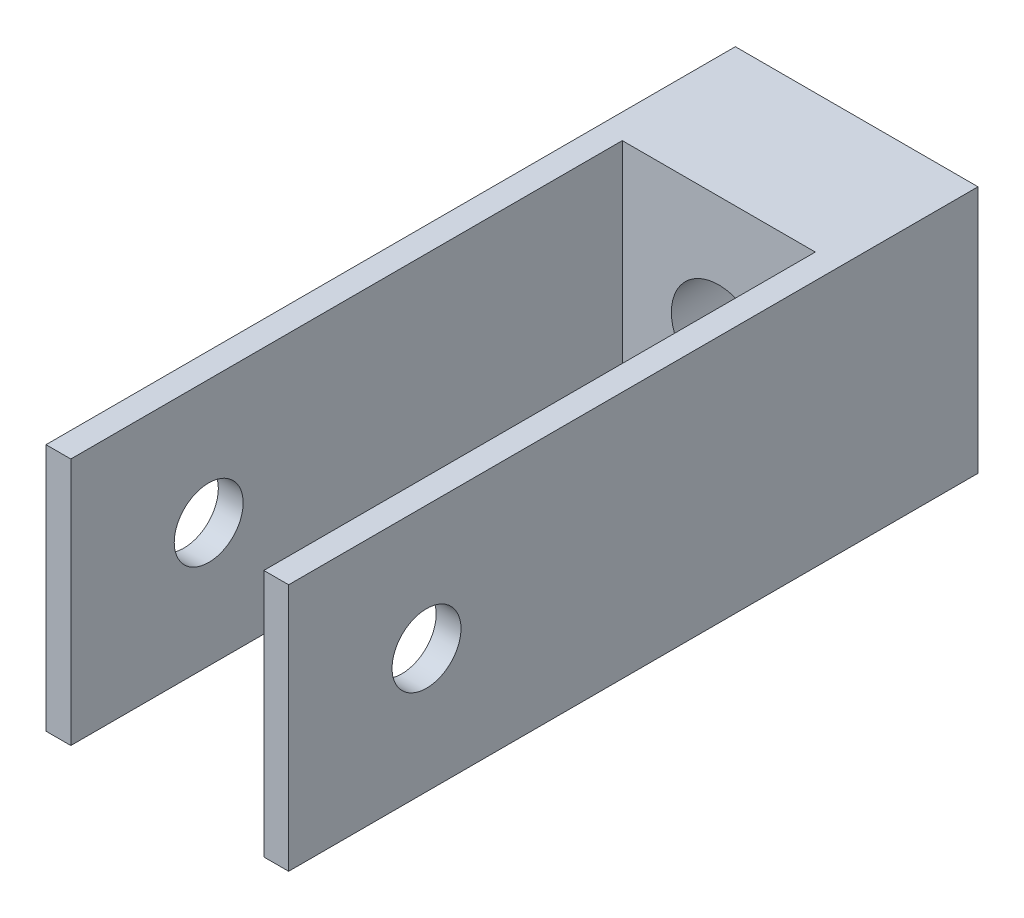
from build123d import *

# Parameters (mm, degrees)
BOSS_EXTRUDE1_DEPTH = 22.86
SKETCH2_R           = 3.175
CUT_EXTRUDE1_DEPTH  = 50.737325059
SKETCH3_R           = 4.365625
CUT_EXTRUDE2_DEPTH  = 23.622


with BuildPart() as part:
    # Sketch1 → Boss-Extrude1 (new body)
    with BuildSketch(Plane(origin=(0, 0, 0), x_dir=(1, 0, 0), z_dir=(0, 1, 0))):
        Polygon((-11.176, -25.4), (-8.89, -25.4), (-8.89, 25.4), (8.89, 25.4), (8.89, -25.4), (11.176, -25.4), (11.176, 38.1), (-11.176, 38.1), align=None)
    extrude(amount=BOSS_EXTRUDE1_DEPTH)

    # Sketch2 → Cut-Extrude1 (cut, through all)
    with BuildSketch(Plane(origin=(11.176, 0, 0), x_dir=(0, 0, -1), z_dir=(1, 0, 0))):
        with Locations((-12.7, 11.43)):
            Circle(SKETCH2_R)
    extrude(amount=-CUT_EXTRUDE1_DEPTH, mode=Mode.SUBTRACT)

    # Sketch3 → Cut-Extrude2 (cut)
    with BuildSketch(Plane(origin=(0, 0, -38.1), x_dir=(-1, 0, 0), z_dir=(0, 0, -1))):
        with Locations((0, 11.43)):
            Circle(SKETCH3_R)
    extrude(amount=-CUT_EXTRUDE2_DEPTH, mode=Mode.SUBTRACT)


solid = part.part
